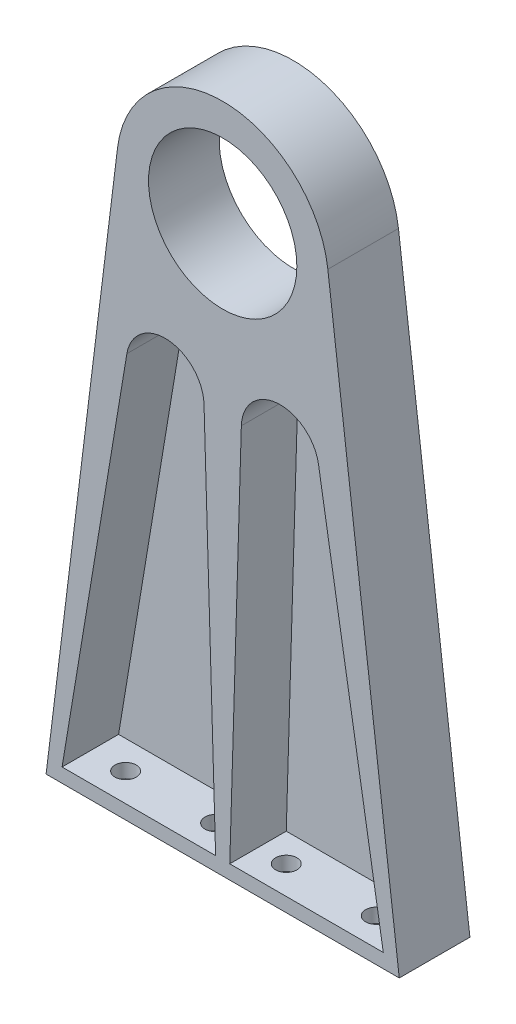
from build123d import *

# Parameters (mm, degrees)
SKETCH_1_R          = 10.5
EXTRUDE_1_DEPTH     = 10
CUT_EXTRUDE_2_DEPTH = 8
SKETCH_3_R          = 1.5
CUT_EXTRUDE_3_DEPTH = 97.81941954


with BuildPart() as part:
    # 草图1 → 凸台-拉伸1 (new body)
    with BuildSketch(Plane.XY):
        with BuildLine():
            Line((-25, 0), (25, 0))
            Line((25, 0), (14.88676655, 81.839614547))
            ThreePointArc((14.88676655, 81.839614547), (0, 95), (-14.88676655, 81.839614547))
            Line((-14.88676655, 81.839614547), (-25, 0))
        make_face()
        with Locations((0, 80)):
            Circle(SKETCH_1_R, mode=Mode.SUBTRACT)
    extrude(amount=EXTRUDE_1_DEPTH)

    # 草图2 → 切除-拉伸2 (cut)
    with BuildSketch(Plane.XY.offset(10)):
        with BuildLine():
            Line((-13.564970556, 57.262621959), (-22.737639737, 2))
            Line((-22.737639737, 2), (-1, 2))
            Line((-1, 2), (-2.641694958, 56.527552532))
            ThreePointArc((-2.641694958, 56.527552532), (-7.769922801, 61.84962447), (-13.564970556, 57.262621959))
        make_face()
        with BuildLine():
            Line((2.641694958, 56.527552532), (1, 2))
            Line((1, 2), (22.737639737, 2))
            Line((22.737639737, 2), (13.564970556, 57.262621959))
            ThreePointArc((13.564970556, 57.262621959), (7.769922801, 61.84962447), (2.641694958, 56.527552532))
        make_face()
    extrude(amount=-CUT_EXTRUDE_2_DEPTH, mode=Mode.SUBTRACT)

    # 草图3 → 切除-拉伸3 (cut, through all)
    with BuildSketch(Plane(origin=(0, 2, 0), x_dir=(1, 0, 0), z_dir=(0, 1, 0))):
        with Locations(Location((-17.74, -6, 0), (0, 0, 180))):
            Circle(SKETCH_3_R)
        with Locations(Location((-5, -6, 0), (0, 0, 180))):
            Circle(SKETCH_3_R)
        with Locations(Location((5, -6, 0), (0, 0, 180))):
            Circle(SKETCH_3_R)
        with Locations(Location((17.74, -6, 0), (0, 0, 180))):
            Circle(SKETCH_3_R)
    extrude(amount=-CUT_EXTRUDE_3_DEPTH, mode=Mode.SUBTRACT)


solid = part.part
